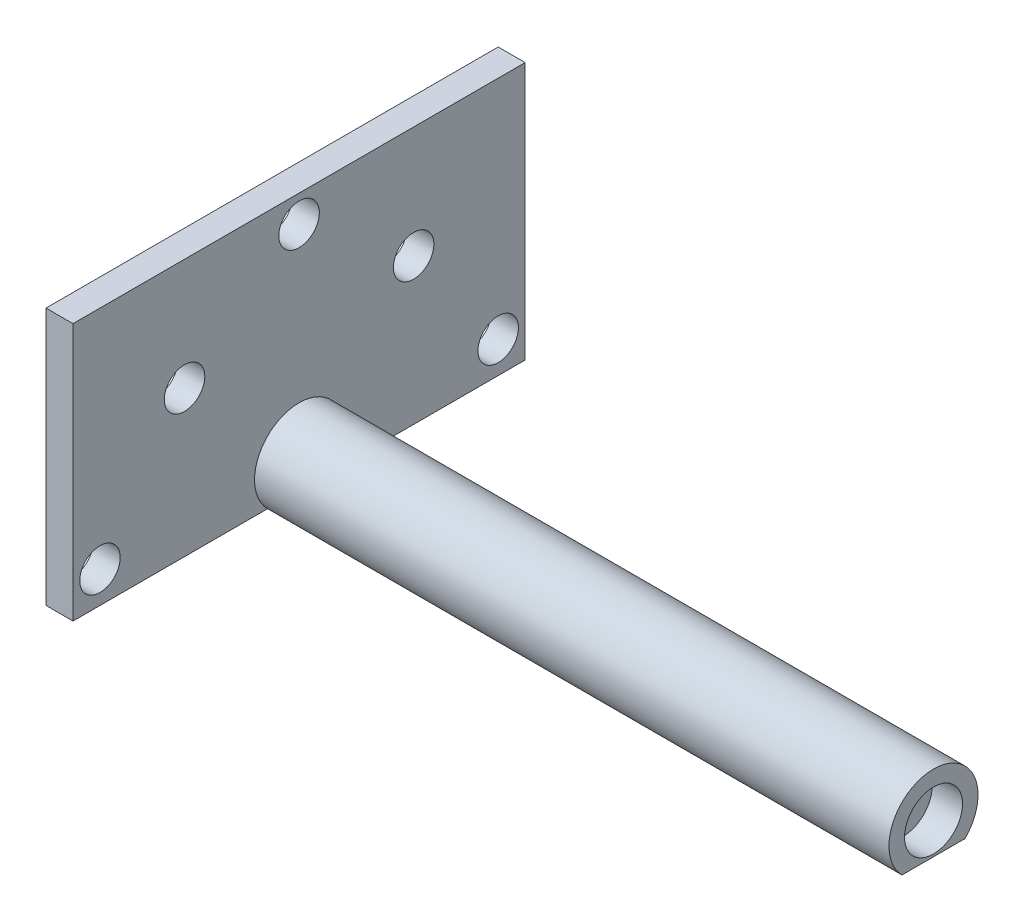
from build123d import *

# Parameters (mm, degrees)
SKETCH1_W           = 33.5
SKETCH1_H           = 19.083452378
SKETCH1_R           = 1.5
BOSS_EXTRUDE1_DEPTH = 2
BOSS_EXTRUDE2_DEPTH = 49
SKETCH3_R           = 2.15
CUT_EXTRUDE1_DEPTH  = 2.25


with BuildPart() as part:
    # Sketch1 → Boss-Extrude1 (new body)
    with BuildSketch(Plane(origin=(0, 0, 0), x_dir=(0, 0, -1), z_dir=(1, 0, 0))):
        with Locations((0, 7.208273811)):
            Rectangle(SKETCH1_W, SKETCH1_H)
        with Locations((-14.75, 0)):
            Circle(SKETCH1_R, mode=Mode.SUBTRACT)
        with Locations((14.75, 0)):
            Circle(SKETCH1_R, mode=Mode.SUBTRACT)
        with Locations((-8.485281374, 8.485281374)):
            Circle(SKETCH1_R, mode=Mode.SUBTRACT)
        with Locations((8.485281374, 8.485281374)):
            Circle(SKETCH1_R, mode=Mode.SUBTRACT)
        with Locations((0, 14.75)):
            Circle(SKETCH1_R, mode=Mode.SUBTRACT)
    extrude(amount=BOSS_EXTRUDE1_DEPTH)

    # Sketch1<3> → Boss-Extrude2 (add)
    with BuildSketch(Plane(origin=(0, 0, 0), x_dir=(0, 0, -1), z_dir=(1, 0, 0))):
        with BuildLine():
            Line((-2.333452378, -2.333452378), (2.333452378, -2.333452378))
            ThreePointArc((2.333452378, -2.333452378), (0, 3.3), (-2.333452378, -2.333452378))
        make_face()
    extrude(amount=BOSS_EXTRUDE2_DEPTH)

    # Sketch3 → Cut-Extrude1 (cut)
    with BuildSketch(Plane(origin=(49, 0, 0), x_dir=(0, 0, -1), z_dir=(1, 0, 0))):
        Circle(SKETCH3_R)
    extrude(amount=-CUT_EXTRUDE1_DEPTH, mode=Mode.SUBTRACT)


solid = part.part
